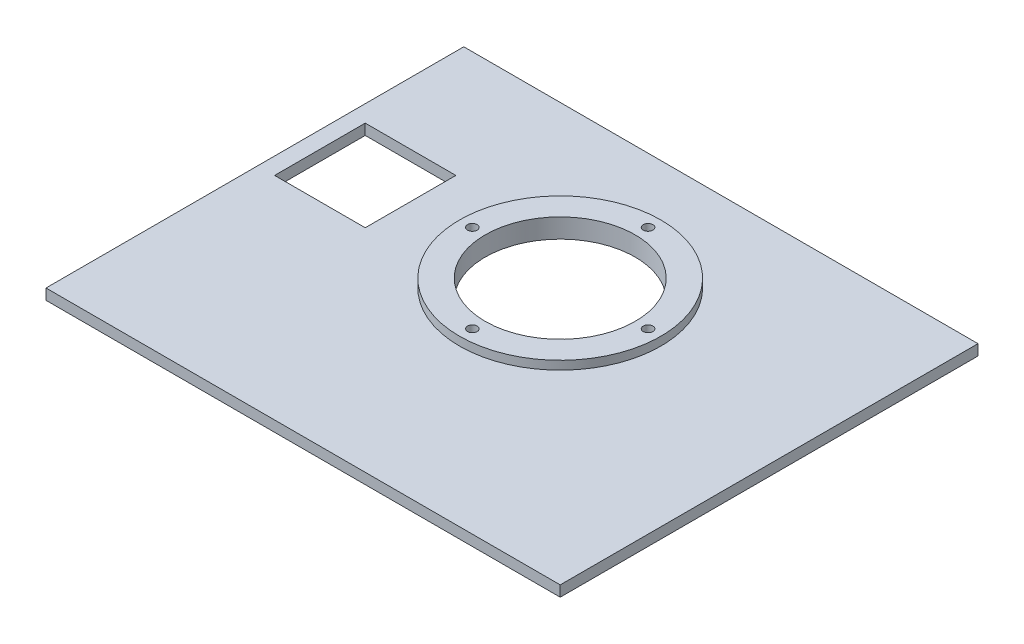
from build123d import *

# Parameters (mm, degrees)
SCHIZZO1_W                   = 240
SCHIZZO1_H                   = 195
SCHIZZO1_R                   = 35
ESTRUSIONE_ESTRUSIONE1_DEPTH = 5
SCHIZZO3_R                   = 47
SCHIZZO3_R_2                 = 35
ESTRUSIONE_ESTRUSIONE2_DEPTH = 4
FORO_PER_VITE_M3_1_D         = 4.5
FORO_PER_VITE_M3_1_DEPTH     = 18.1
FORO_PER_VITE_M3_1_TIP       = 1.351936393
SCHIZZO7_W                   = 42.3
SCHIZZO7_H                   = 42.3
TAGLIO_ESTRUSIONE1_DEPTH     = 14


with BuildPart() as part:
    # Schizzo1 → Estrusione-Estrusione1 (new body)
    with BuildSketch(Plane(origin=(0, 0, 0), x_dir=(1, 0, 0), z_dir=(0, 1, 0))):
        with Locations((0, -22.5)):
            Rectangle(SCHIZZO1_W, SCHIZZO1_H)
        with Locations(Location((0, 0, 0), (0, 0, 270))):
            Circle(SCHIZZO1_R, mode=Mode.SUBTRACT)
    extrude(amount=ESTRUSIONE_ESTRUSIONE1_DEPTH)

    # Schizzo3 → Estrusione-Estrusione2 (add)
    with BuildSketch(Plane(origin=(0, 5, 0), x_dir=(1, 0, 0), z_dir=(0, 1, 0))):
        with Locations(Location((0, 0, 0), (0, 0, 270))):
            Circle(SCHIZZO3_R)
        with Locations(Location((0, 0, 0), (0, 0, 270))):
            Circle(SCHIZZO3_R_2, mode=Mode.SUBTRACT)
    extrude(amount=ESTRUSIONE_ESTRUSIONE2_DEPTH)

    # Foro per Vite M3-1
    with Locations(Plane(origin=(0, 0, 0), x_dir=(-1, 0, 0), z_dir=(0, -1, 0))):
        with Locations((-41, 0), (0, 41), (41, 0), (0, -41)):
            Hole(FORO_PER_VITE_M3_1_D / 2, depth=FORO_PER_VITE_M3_1_DEPTH)
            with Locations((0, 0, -(FORO_PER_VITE_M3_1_DEPTH + FORO_PER_VITE_M3_1_TIP / 2))):  # 118° drill point
                Cone(0, FORO_PER_VITE_M3_1_D / 2, FORO_PER_VITE_M3_1_TIP, mode=Mode.SUBTRACT)

    # Schizzo7 → Taglio-Estrusione1 (cut)
    with BuildSketch(Plane(origin=(0, 5, 0), x_dir=(1, 0, 0), z_dir=(0, 1, 0))):
        with Locations((-91, 0)):
            Rectangle(SCHIZZO7_W, SCHIZZO7_H)
    extrude(amount=-TAGLIO_ESTRUSIONE1_DEPTH, mode=Mode.SUBTRACT)


solid = part.part
